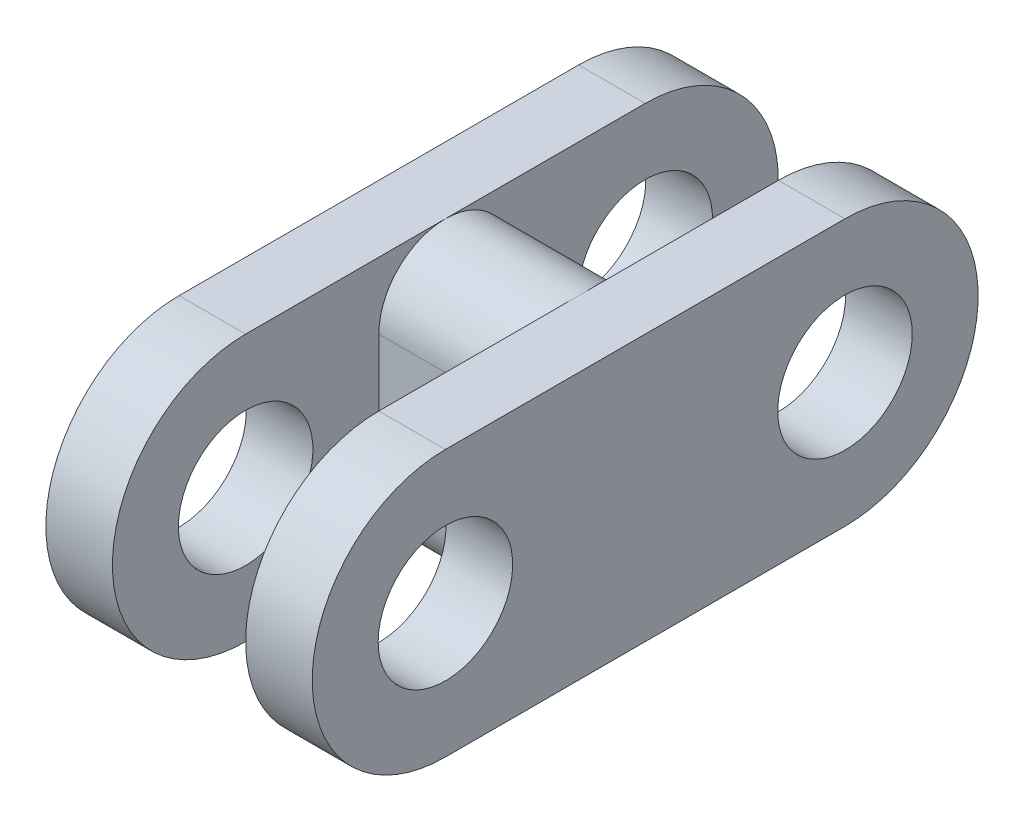
from build123d import *

# Parameters (mm, degrees)
BOSS_EXTRUDE1_DEPTH = 2.5
BOSS_EXTRUDE2_DEPTH = 5
BOSS_EXTRUDE3_DEPTH = 2.5
HOLE1_D             = 5.05
HOLE1_DEPTH         = 2.5
HOLE2_D             = 5.05
HOLE2_DEPTH         = 2.5
HOLE3_D             = 5.05
HOLE3_DEPTH         = 10


with BuildPart() as part:
    # Sketch1 → Boss-Extrude1 (new body)
    with BuildSketch(Plane(origin=(0, 0, 0), x_dir=(0, -1, 0), z_dir=(-1, 0, 0))):
        with BuildLine():
            Line((0, 20), (0, 5))
            ThreePointArc((0, 5), (5, 0), (10, 5))
            Line((10, 5), (10, 20))
            ThreePointArc((10, 20), (5, 25), (0, 20))
        make_face()
    extrude(amount=-BOSS_EXTRUDE1_DEPTH)

    # Sketch2 → Boss-Extrude2 (add)
    with BuildSketch(Plane(origin=(2.5, 0, 0), x_dir=(0, 0, -1), z_dir=(1, 0, 0))):
        with BuildLine():
            Line((-15, -7.5), (-15, -2.5))
            ThreePointArc((-15, -2.5), (-12.5, 0), (-10, -2.5))
            Line((-10, -2.5), (-10, -7.5))
            ThreePointArc((-10, -7.5), (-12.5, -10), (-15, -7.5))
        make_face()
    extrude(amount=BOSS_EXTRUDE2_DEPTH)

    # Sketch3 → Boss-Extrude3 (add)
    with BuildSketch(Plane(origin=(7.5, 0, 0), x_dir=(0, 0, -1), z_dir=(1, 0, 0))):
        with BuildLine():
            Line((-20, 0), (-5, 0))
            ThreePointArc((-5, 0), (0, -5), (-5, -10))
            Line((-5, -10), (-20, -10))
            ThreePointArc((-20, -10), (-25, -5), (-20, 0))
        make_face()
    extrude(amount=BOSS_EXTRUDE3_DEPTH)

    # Hole1
    with Locations(Plane(origin=(10, 0, 0), x_dir=(0, 0, -1), z_dir=(1, 0, 0))):
        with Locations((-5, -5)):
            Hole(HOLE1_D / 2, depth=HOLE1_DEPTH)

    # Hole2
    with Locations(Plane.ZY.offset(-7.5)):
        with Locations((20, -5)):
            Hole(HOLE2_D / 2, depth=HOLE2_DEPTH)

    # Hole3
    with Locations(Plane.ZY):
        with Locations((20, -5), (5, -5)):
            Hole(HOLE3_D / 2, depth=HOLE3_DEPTH)


solid = part.part
